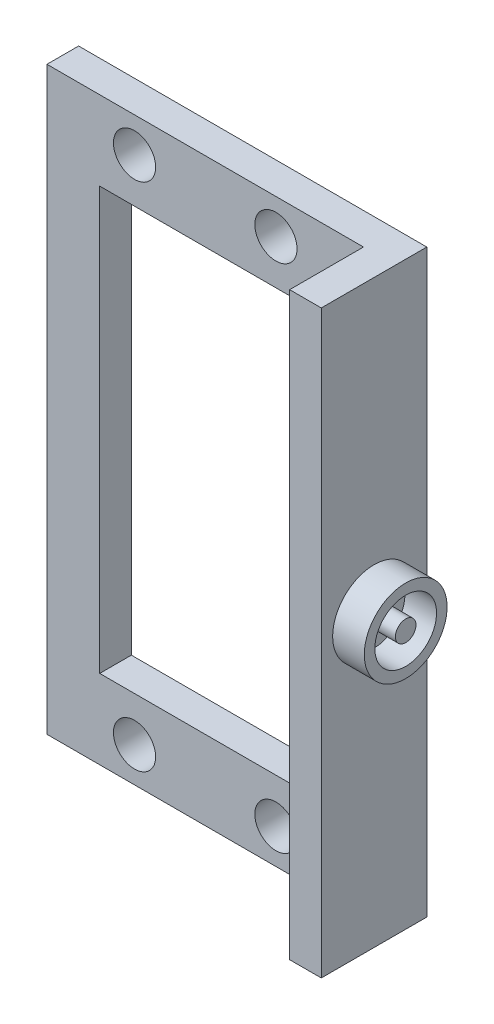
from build123d import *

# Parameters (mm, degrees)
SKETCH1_W                    = 30
SKETCH1_H                    = 55
SKETCH1_W_2                  = 20
SKETCH1_H_2                  = 40
SERVO_MOUNT_DEPTH            = 3
F_4_0_4_DIAMETER_HOLE1_D     = 4
F_4_0_4_DIAMETER_HOLE1_DEPTH = 4
F_4_0_4_DIAMETER_HOLE1_TIP   = 1.201721238
SKETCH4_W                    = 10
SKETCH4_H                    = 55
AXLE_MOUNT_BASE_DEPTH        = 3
AXLE_START                   = 3
SKETCH4_3_R                  = 0.975
AXLE_MOUNT_DEPTH             = 3


with BuildPart() as part:
    # Sketch1 → Servo Mount (new body)
    with BuildSketch(Plane.XY):
        with Locations((0, 20)):
            Rectangle(SKETCH1_W, SKETCH1_H)
        with Locations((0, 20)):
            Rectangle(SKETCH1_W_2, SKETCH1_H_2, mode=Mode.SUBTRACT)
    extrude(amount=SERVO_MOUNT_DEPTH)

    # Ø4.0 (4) Diameter Hole1
    with Locations(Plane.XY.offset(3)):
        with Locations((-6.7, 44.2), (-6.7, -4.2), (6.7, 44.2), (6.7, -4.2)):
            Hole(F_4_0_4_DIAMETER_HOLE1_D / 2, depth=F_4_0_4_DIAMETER_HOLE1_DEPTH)
            with Locations((0, 0, -(F_4_0_4_DIAMETER_HOLE1_DEPTH + F_4_0_4_DIAMETER_HOLE1_TIP / 2))):  # 118° drill point
                Cone(0, F_4_0_4_DIAMETER_HOLE1_D / 2, F_4_0_4_DIAMETER_HOLE1_TIP, mode=Mode.SUBTRACT)

    # Sketch4 → Axle Mount Base (add)
    with BuildSketch(Plane(origin=(15, 0, 0), x_dir=(0, 0, -1), z_dir=(1, 0, 0))):
        with Locations((-5, 20)):
            Rectangle(SKETCH4_W, SKETCH4_H)
    extrude(amount=AXLE_MOUNT_BASE_DEPTH)

    # Sketch4<3> → Axle Mount (add)
    with BuildSketch(Plane(origin=(15, 0, 0), x_dir=(0, 0, -1), z_dir=(1, 0, 0)).offset(AXLE_START)):
        with BuildLine():
            Line((-3, 17.865608986), (-3, 16.622778509))
            ThreePointArc((-3, 16.622778509), (-1.590042156, 18.056340436), (-1.075, 20))
            ThreePointArc((-1.075, 20), (-1.590042156, 21.943659564), (-3, 23.377221491))
            Line((-3, 23.377221491), (-3, 22.134391014))
            ThreePointArc((-3, 22.134391014), (-2.3161944, 21.163104681), (-2.075, 20))
            ThreePointArc((-2.075, 20), (-2.3161944, 18.836895319), (-3, 17.865608986))
        make_face()
        with BuildLine():
            ThreePointArc((-3, 23.377221491), (-8.925, 20), (-3, 16.622778509))
            Line((-3, 16.622778509), (-3, 17.865608986))
            ThreePointArc((-3, 17.865608986), (-7.925, 20), (-3, 22.134391014))
            Line((-3, 22.134391014), (-3, 23.377221491))
        make_face()
        with Locations(Location((-5, 20, 0), (0, 0, 180))):
            Circle(SKETCH4_3_R)
    extrude(amount=AXLE_MOUNT_DEPTH)


solid = part.part
